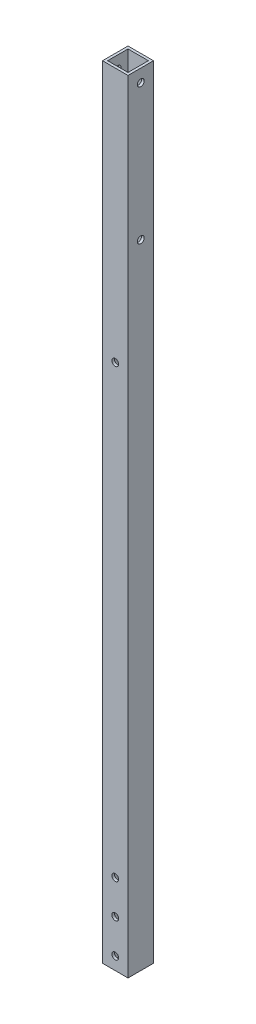
from build123d import *

# Parameters (mm, degrees)
SKETCH_1_W          = 15
SKETCH_1_H          = 15
SKETCH_1_W_2        = 12
SKETCH_1_H_2        = 12
EXTRUDE_1_DEPTH     = 460
SKETCH_2_R          = 2
CUT_EXTRUDE_1_DEPTH = 461.305605006
SKETCH_3_R          = 2
CUT_EXTRUDE_2_DEPTH = 461.305605006


with BuildPart() as part:
    # ｽｹｯﾁ1 → 押し出し-薄板1 (new body)
    with BuildSketch(Plane(origin=(0, 0, 0), x_dir=(1, 0, 0), z_dir=(0, 1, 0))):
        Rectangle(SKETCH_1_W, SKETCH_1_H)
        Rectangle(SKETCH_1_W_2, SKETCH_1_H_2, mode=Mode.SUBTRACT)
    extrude(amount=EXTRUDE_1_DEPTH)

    # ｽｹｯﾁ2 → ｶｯﾄ - 押し出し1 (cut, through all)
    with BuildSketch(Plane(origin=(7.5, 0, 0), x_dir=(0, 0, -1), z_dir=(1, 0, 0))):
        with Locations((0, 452.5)):
            Circle(SKETCH_2_R)
        with Locations((0, 372.5)):
            Circle(SKETCH_2_R)
    extrude(amount=-CUT_EXTRUDE_1_DEPTH, mode=Mode.SUBTRACT)

    # ｽｹｯﾁ3 → ｶｯﾄ - 押し出し2 (cut, through all)
    with BuildSketch(Plane.XY.offset(7.5)):
        with Locations((0, 7.5)):
            Circle(SKETCH_3_R)
        with Locations((0, 47.5)):
            Circle(SKETCH_3_R)
        with Locations((0, 27.5)):
            Circle(SKETCH_3_R)
        with Locations((0, 310)):
            Circle(SKETCH_3_R)
    extrude(amount=-CUT_EXTRUDE_2_DEPTH, mode=Mode.SUBTRACT)


solid = part.part
